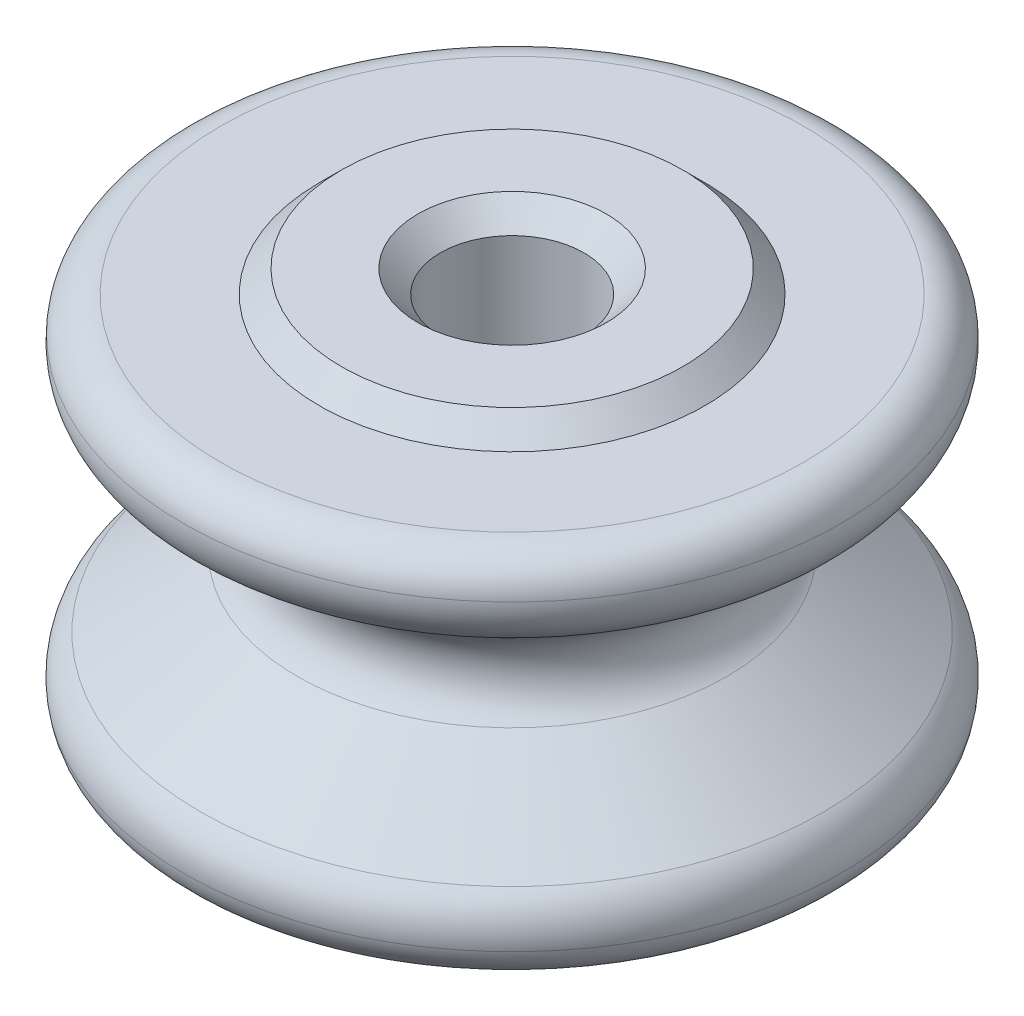
from build123d import *

# Parameters (mm, degrees)
SZKIC5_R                   = 3.2
WYTNIJ_WYCI_GNI_CIE1_DEPTH = 19


with BuildPart() as part:
    # Szkic1 → Obrót1 (revolve)
    with BuildSketch(Plane.XY, mode=Mode.PRIVATE) as obr_t1_sk:
        with BuildLine():
            Line((0, -16.5), (1, -17.5))
            Line((1, -17.5), (4.4, -17.5))
            Line((4.4, -17.5), (5.4, -16.5))
            Line((5.4, -16.5), (9.78348732, -16.5))
            ThreePointArc((9.78348732, -16.5), (10.913937759, -16.070336685), (11.473614893, -14.998287122))
            ThreePointArc((11.473614893, -14.998287122), (11.326095192, -13.919522313), (10.672757631, -13.048519668))
            Line((10.672757631, -13.048519668), (6.370526458, -9.966460766))
            ThreePointArc((6.370526458, -9.966460766), (5.5, -8.24315268), (6.348844005, -6.509061873))
            Line((6.348844005, -6.509061873), (10.670037967, -3.453646536))
            ThreePointArc((10.670037967, -3.453646536), (11.32543403, -2.582085517), (11.473614893, -1.501712878))
            ThreePointArc((11.473614893, -1.501712878), (10.913937759, -0.429663315), (9.78348732, 0))
            Line((9.78348732, 0), (5.4, 0))
            Line((5.4, 0), (4.4, 1))
            Line((4.4, 1), (1, 1))
            Line((1, 1), (0, 0))
            Line((0, 0), (-3.2, 0))
            Line((-3.2, 0), (-3.2, -16.5))
            Line((-3.2, -16.5), (0, -16.5))
        make_face()
    revolve(obr_t1_sk.sketch.rotate(Axis((-3.2, 0, 0), (0, -1, 0)), 180), axis=Axis((-3.2, 0, 0), (0, -1, 0)))

    # Szkic5 → Wytnij-wyciągnięcie1 (cut)
    with BuildSketch(Plane(origin=(0, 0, 0), x_dir=(1, 0, 0), z_dir=(0, 1, 0))):
        with Locations(Location((-3.2, 0, 0), (0, 0, 180))):
            Circle(SZKIC5_R)
    extrude(amount=-WYTNIJ_WYCI_GNI_CIE1_DEPTH, mode=Mode.SUBTRACT)


solid = part.part
